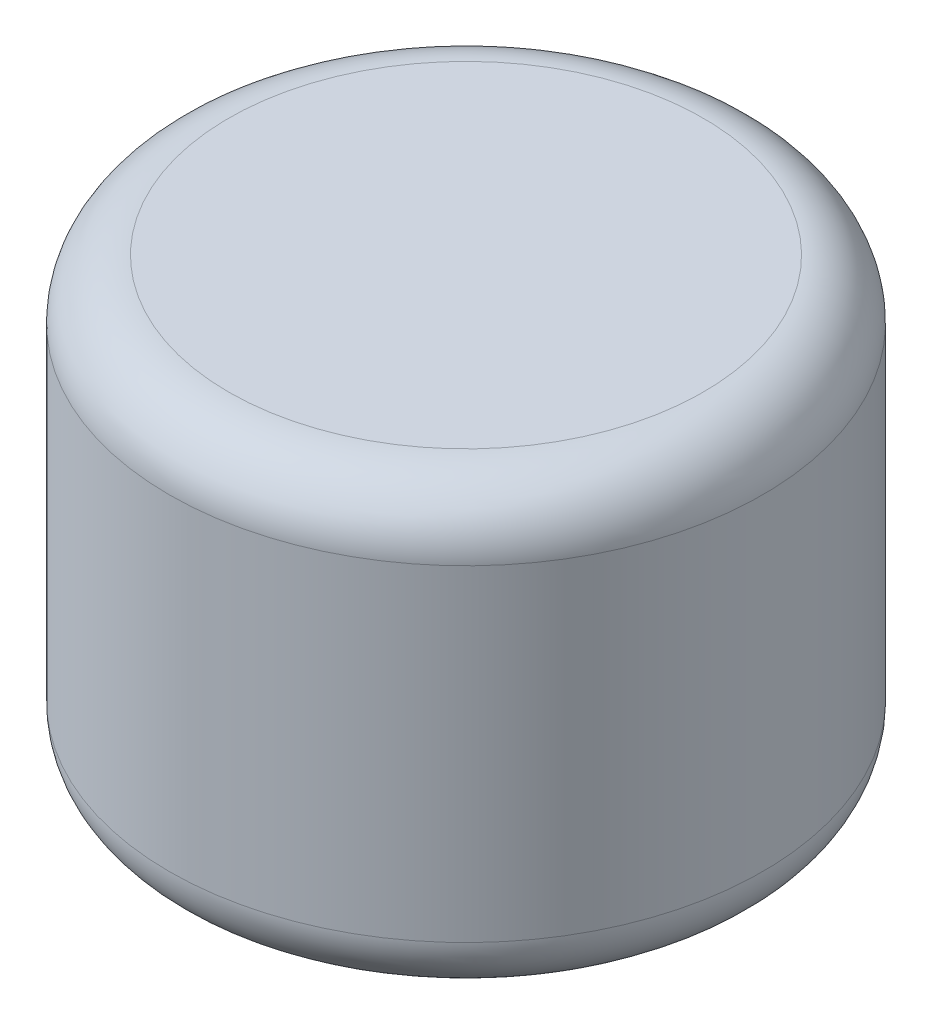
from build123d import *

# Parameters (mm, degrees)
SKETCH3_R           = 2
BOSS_EXTRUDE2_DEPTH = 1.5
FILLET1_R           = 0.4


with BuildPart() as part:
    # Sketch3 → Boss-Extrude2 (new, symmetric)
    with BuildSketch(Plane(origin=(0, 0, 0), x_dir=(1, 0, 0), z_dir=(0, 1, 0))):
        with Locations(Location((0, 0, 0), (0, 0, 270))):
            Circle(SKETCH3_R)
    extrude(amount=BOSS_EXTRUDE2_DEPTH, both=True)

    # Fillet1
    fillet1_edges = [part.edges().sort_by_distance(p)[0] for p in [
        (0, -1.5, -2),
        (0, 1.5, -2),
    ]]
    fillet(fillet1_edges, radius=FILLET1_R)


solid = part.part
